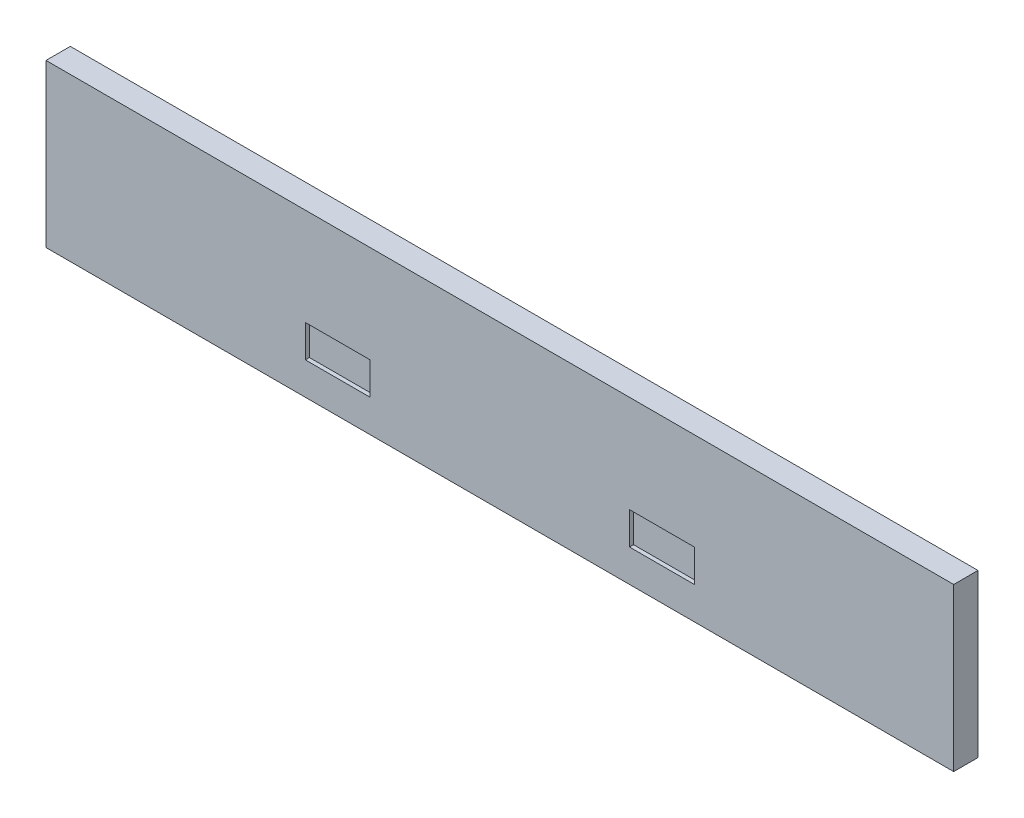
from build123d import *

# Parameters (mm, degrees)
SKETCH1_W           = 711.2
SKETCH1_H           = 127
BOSS_EXTRUDE1_DEPTH = 19.05
SKETCH2_W           = 50.8
SKETCH2_H           = 25.4
CUT_EXTRUDE1_DEPTH  = 3.175


with BuildPart() as part:
    # Sketch1 → Boss-Extrude1 (new body)
    with BuildSketch(Plane.XY):
        with Locations((355.6, 63.5)):
            Rectangle(SKETCH1_W, SKETCH1_H)
    extrude(amount=BOSS_EXTRUDE1_DEPTH)

    # Sketch2 → Cut-Extrude1 (cut)
    with BuildSketch(Plane.XY.offset(19.05)):
        with Locations((228.6, 38.1)):
            Rectangle(SKETCH2_W, SKETCH2_H)
        with Locations((482.6, 38.1)):
            Rectangle(SKETCH2_W, SKETCH2_H)
    extrude(amount=-CUT_EXTRUDE1_DEPTH, mode=Mode.SUBTRACT)


solid = part.part
